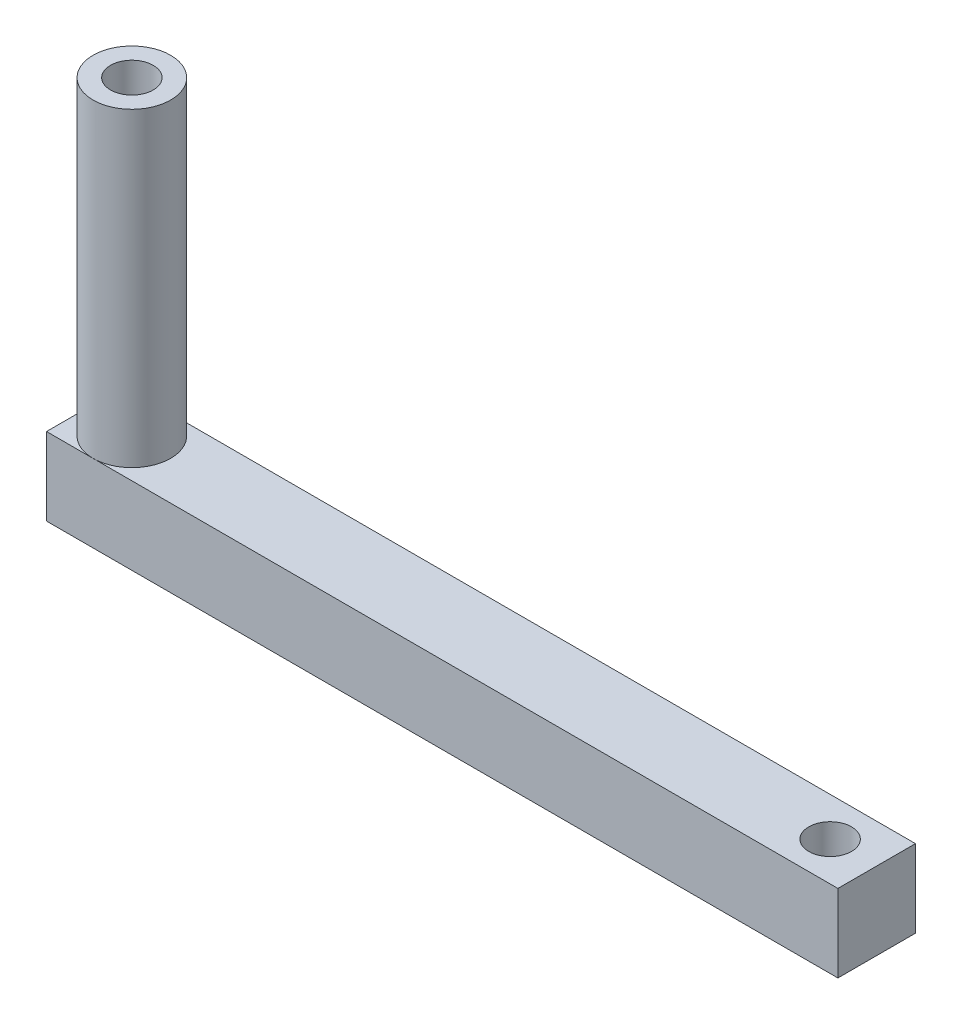
from build123d import *

# Parameters (mm, degrees)
SKETCH1_W           = 64.77
SKETCH1_H           = 6.35
SKETCH1_R           = 1.75
BOSS_EXTRUDE1_DEPTH = 6.35
BOSS_EXTRUDE2_START = -31.75
SKETCH2_R           = 3.175
SKETCH2_R_2         = 1.75
BOSS_EXTRUDE2_DEPTH = 25.4


with BuildPart() as part:
    # Sketch1 → Boss-Extrude1 (new body)
    with BuildSketch(Plane(origin=(0, 0, 0), x_dir=(1, 0, 0), z_dir=(0, 1, 0))):
        with Locations((32.385, 3.175)):
            Rectangle(SKETCH1_W, SKETCH1_H)
        with Locations(Location((3.81, 3.175, 0), (0, 0, 270))):
            Circle(SKETCH1_R, mode=Mode.SUBTRACT)
        with Locations(Location((60.96, 3.175, 0), (0, 0, 270))):
            Circle(SKETCH1_R, mode=Mode.SUBTRACT)
    extrude(amount=-BOSS_EXTRUDE1_DEPTH)

    # Sketch2 → Boss-Extrude2 (add)
    with BuildSketch(Plane.XZ.offset(6.35).offset(BOSS_EXTRUDE2_START)):
        with Locations(Location((3.81, -3.175, 0), (0, 0, 270))):
            Circle(SKETCH2_R)
        with Locations(Location((3.81, -3.175, 0), (0, 0, 90))):
            Circle(SKETCH2_R_2, mode=Mode.SUBTRACT)
    extrude(amount=BOSS_EXTRUDE2_DEPTH)


solid = part.part
